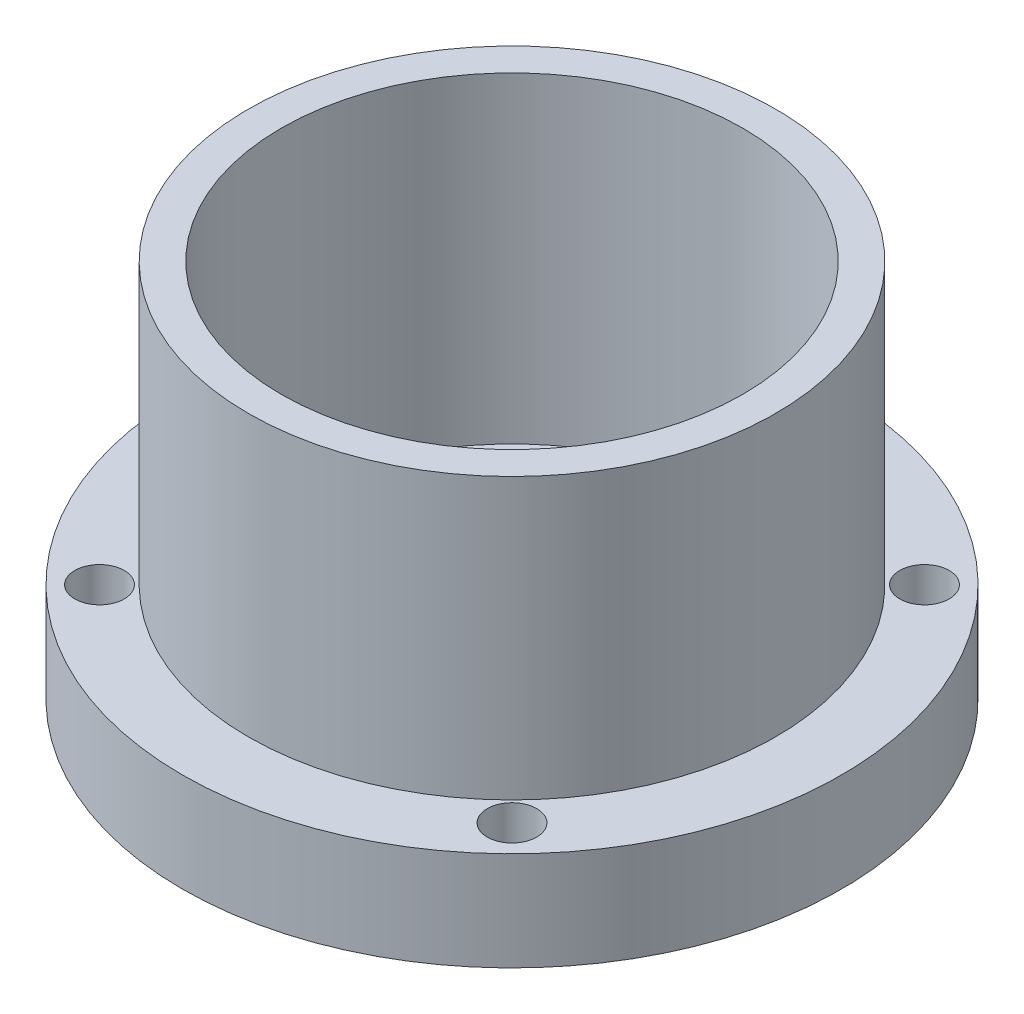
from build123d import *

# Parameters (mm, degrees)
CARTRIDGE_BARREL_SKETCH_R         = 16
CARTRIDGE_BARREL_DEPTH            = 17
SIX_MILLIMETRE_FLANGE_SKETCH_R    = 20
SIX_MILLIMETRE_FLANGE_DEPTH       = 6
BEARING_BORE_SKETCH_R             = 14
BEARING_BORE_DEPTH                = 19.6
OUTER_RACE_SHOULDER_EXIT_SKETCH_R = 13
OUTER_RACE_SHOULDER_EXIT_DEPTH    = 3.6
M3_TAPPED_HOLE_PATTERN_SKETCH_R   = 1.5
M3_TAPPED_HOLE_PATTERN_DEPTH      = 6.2


with BuildPart() as part:
    # Cartridge barrel sketch → Cartridge barrel (new body)
    with BuildSketch(Plane(origin=(0, -237.5, 0), x_dir=(1, 0, 0), z_dir=(0, 1, 0))):
        with Locations(Location((-19.009182883, 53.244882879, 0), (0, 0, 270))):
            Circle(CARTRIDGE_BARREL_SKETCH_R)
    extrude(amount=CARTRIDGE_BARREL_DEPTH)

    # Six millimetre flange sketch → Six millimetre flange (add)
    with BuildSketch(Plane(origin=(0, -220.5, 0), x_dir=(1, 0, 0), z_dir=(0, 1, 0))):
        with Locations(Location((-19.009182883, 53.244882879, 0), (0, 0, 270))):
            Circle(SIX_MILLIMETRE_FLANGE_SKETCH_R)
    extrude(amount=SIX_MILLIMETRE_FLANGE_DEPTH)

    # Bearing bore sketch → Bearing bore (cut)
    with BuildSketch(Plane(origin=(0, -237.6, 0), x_dir=(1, 0, 0), z_dir=(0, 1, 0))):
        with Locations(Location((-19.009182883, 53.244882879, 0), (0, 0, 270))):
            Circle(BEARING_BORE_SKETCH_R)
    extrude(amount=BEARING_BORE_DEPTH, mode=Mode.SUBTRACT)

    # Outer race shoulder exit sketch → Outer race shoulder exit (cut)
    with BuildSketch(Plane(origin=(0, -218, 0), x_dir=(1, 0, 0), z_dir=(0, 1, 0))):
        with Locations(Location((-19.009182883, 53.244882879, 0), (0, 0, 270))):
            Circle(OUTER_RACE_SHOULDER_EXIT_SKETCH_R)
    extrude(amount=OUTER_RACE_SHOULDER_EXIT_DEPTH, mode=Mode.SUBTRACT)

    # M3 tapped hole pattern sketch → M3 tapped hole pattern (cut)
    with BuildSketch(Plane(origin=(0, -220.6, 0), x_dir=(1, 0, 0), z_dir=(0, 1, 0))):
        with Locations(Location((-6.493392856, 40.729092852, 0), (0, 0, 270))):
            Circle(M3_TAPPED_HOLE_PATTERN_SKETCH_R)
        with Locations(Location((-31.52497291, 40.729092852, 0), (0, 0, 270))):
            Circle(M3_TAPPED_HOLE_PATTERN_SKETCH_R)
        with Locations(Location((-31.52497291, 65.760672906, 0), (0, 0, 270))):
            Circle(M3_TAPPED_HOLE_PATTERN_SKETCH_R)
        with Locations(Location((-6.493392856, 65.760672906, 0), (0, 0, 270))):
            Circle(M3_TAPPED_HOLE_PATTERN_SKETCH_R)
    extrude(amount=M3_TAPPED_HOLE_PATTERN_DEPTH, mode=Mode.SUBTRACT)


with BuildPart() as body_2:
    # Mirror1: mirrored copy
    add(part.part.mirror(Plane(origin=(0, 0, 0), x_dir=(0, 0, 1), z_dir=(0, -1, 0))))


solid = body_2.part
